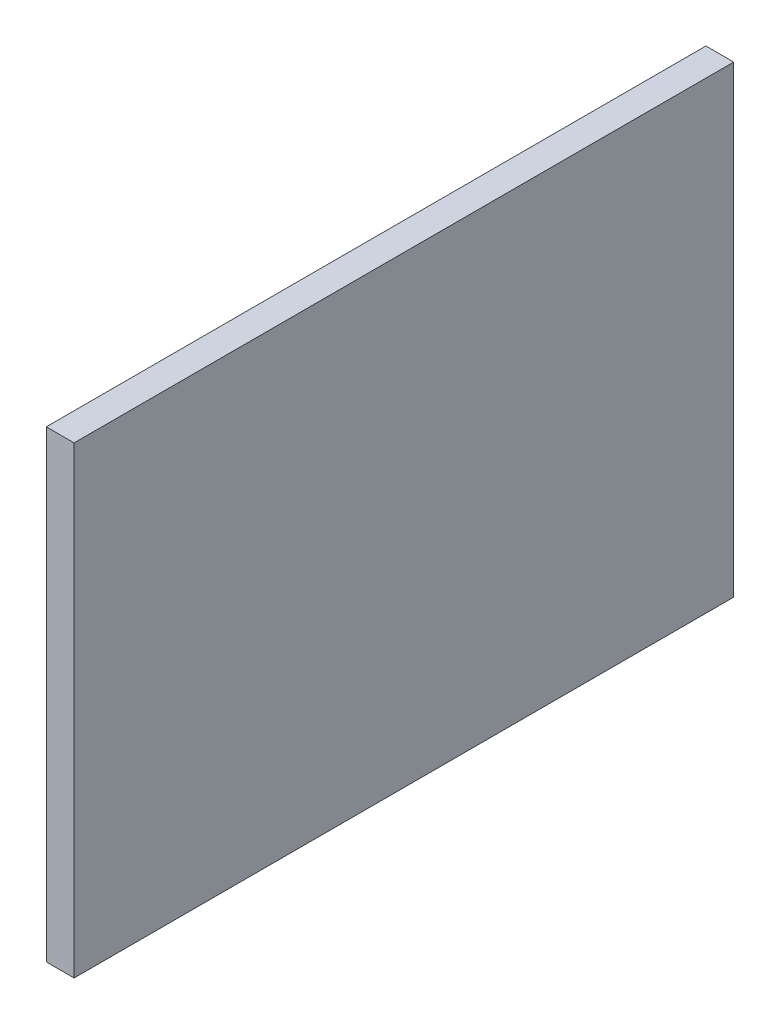
from build123d import *

# Parameters (mm, degrees)
SKETCH1_W           = 427
SKETCH1_H           = 300
BOSS_EXTRUDE1_DEPTH = 18


with BuildPart() as part:
    # Sketch1 → Boss-Extrude1 (new body)
    with BuildSketch(Plane(origin=(0, 0, 0), x_dir=(0, 0, -1), z_dir=(1, 0, 0))):
        with Locations((213.5, 150)):
            Rectangle(SKETCH1_W, SKETCH1_H)
    extrude(amount=BOSS_EXTRUDE1_DEPTH)


solid = part.part
